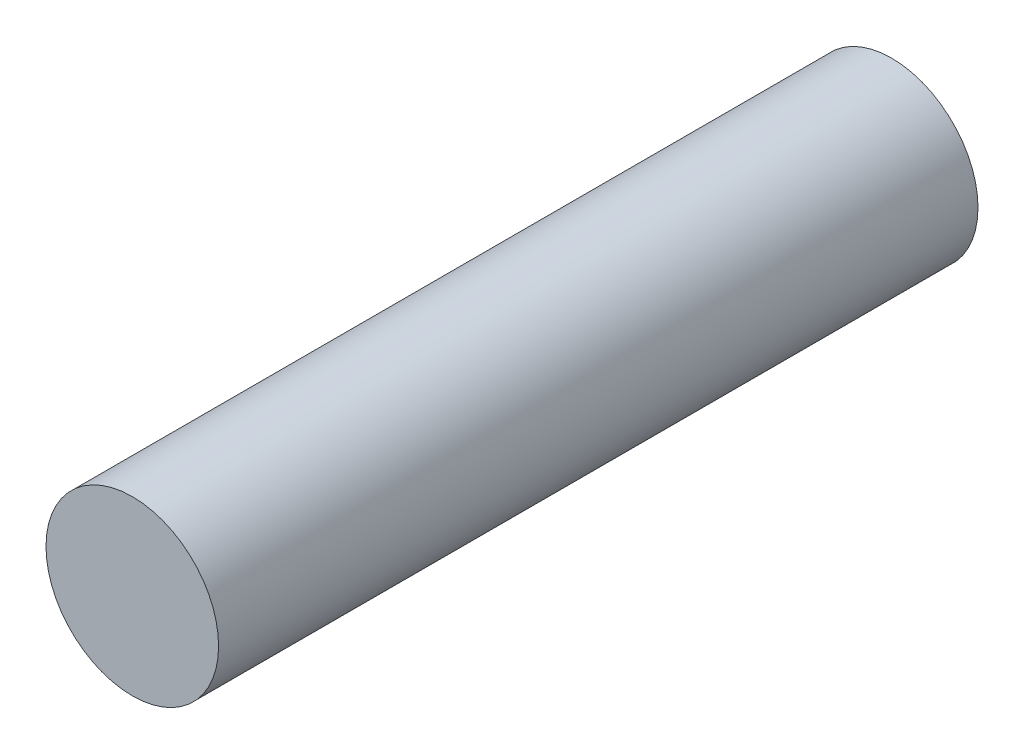
from build123d import *

# Parameters (mm, degrees)
SKETCH1_W = 34.925
SKETCH1_H = 3.96875


with BuildPart() as part:
    # Sketch1 → Revolve1 (revolve)
    with BuildSketch(Plane(origin=(0, 0, 0), x_dir=(0, 0, -1), z_dir=(1, 0, 0)), mode=Mode.PRIVATE) as revolve1_sk:
        with Locations((17.4625, -1.984375)):
            Rectangle(SKETCH1_W, SKETCH1_H)
    revolve(revolve1_sk.sketch.rotate(Axis((0, 0, 0), (0, 0, 1)), 270), axis=Axis((0, 0, 0), (0, 0, 1)))


solid = part.part
